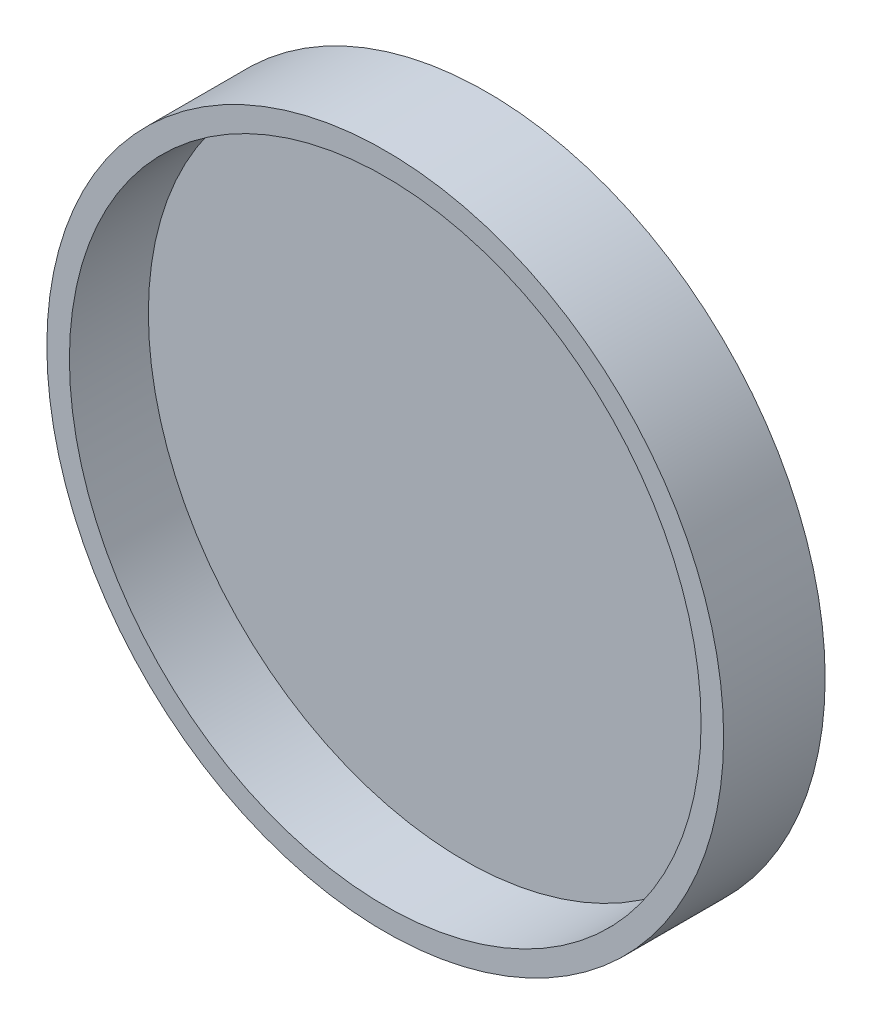
from build123d import *

# Parameters (mm, degrees)
SKETCH2_R           = 15
BOSS_EXTRUDE1_DEPTH = 4.5
SKETCH3_R           = 14
CUT_EXTRUDE1_DEPTH  = 3.5


with BuildPart() as part:
    # Sketch2 → Boss-Extrude1 (new body)
    with BuildSketch(Plane.XY):
        Circle(SKETCH2_R)
    extrude(amount=BOSS_EXTRUDE1_DEPTH)

    # Sketch3 → Cut-Extrude1 (cut)
    with BuildSketch(Plane.XY.offset(4.5)):
        Circle(SKETCH3_R)
    extrude(amount=-CUT_EXTRUDE1_DEPTH, mode=Mode.SUBTRACT)


solid = part.part
